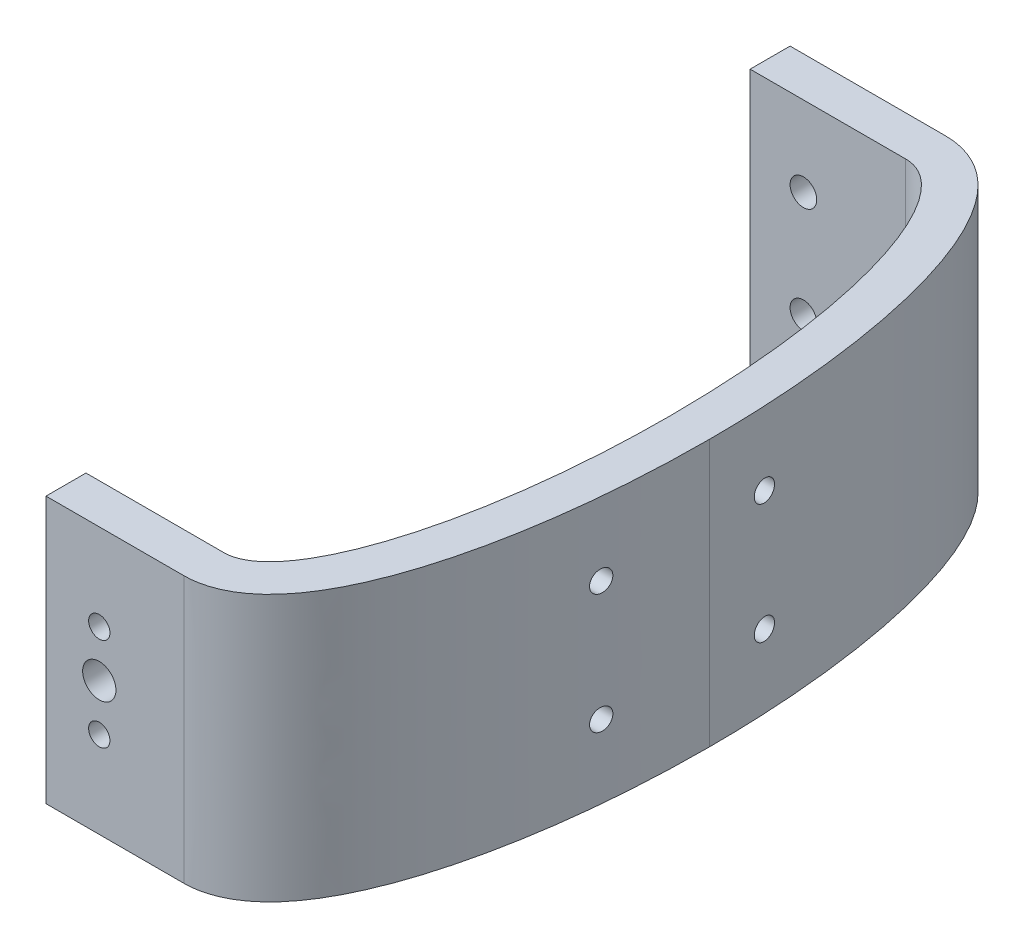
from build123d import *

# Parameters (mm, degrees)
EXTRUDE_1_DEPTH     = 40
SKETCH_2_W          = 20.699792116
SKETCH_2_H          = 40
EXTRUDE_2_DEPTH     = 6
SKETCH_3_W          = 23.355434
SKETCH_3_H          = 40
EXTRUDE_3_DEPTH     = 6
SKETCH_4_R          = 1.6
SKETCH_4_R_2        = 2.5
CUT_EXTRUDE_1_DEPTH = 6
SKETCH_5_R          = 2
CUT_EXTRUDE_2_DEPTH = 6
SKETCH_6_R          = 1.6
CUT_EXTRUDE_3_DEPTH = 50
SKETCH_7_R          = 3
CUT_EXTRUDE_4_DEPTH = 8.5


with BuildPart() as part:
    # 草图1 → 凸台-拉伸1 (new body)
    with BuildSketch(Plane(origin=(0, 20, 0), x_dir=(-1, 0, 0), z_dir=(0, -1, 0))):
        with BuildLine():
            Line((-222.278378746, 60.718506671), (-222.278378746, 54.718506671))
            add(Edge.make_bspline(
                [(-222.278378746, 54.718506671), (-230.961190407, 54.718506671), (-238, 31.801176865), (-238, 3.53121788)],
                knots=[0, 0, 0, 0, 1, 1, 1, 1], degree=3))
            add(Edge.make_bspline(
                [(-238, 3.53121788), (-238, -24.738741104), (-230.961190407, -47.656070911), (-222.278378746, -47.656070911)],
                knots=[0, 0, 0, 0, 1, 1, 1, 1], degree=3))
            Line((-222.278378746, -47.656070911), (-222.278378746, -53.656070911))
            add(Edge.make_bspline(
                [(-222.278378746, -53.656070911), (-223.180271244, -53.656070911), (-224.07933128, -53.571054967), (-224.960759777, -53.401588789), (-225.809203297, -53.154351153), (-226.615610963, -52.841063111), (-227.377447744, -52.473741453), (-228.814318367, -51.648078689), (-230.088209946, -50.667712485), (-230.687109525, -50.145609931), (-231.252366306, -49.596041043), (-231.788248358, -49.021505836), (-232.298365535, -48.423329927), (-233.760558431, -46.560400285), (-235.040687912, -44.496180714), (-235.833189955, -43.034044994), (-236.575699117, -41.484412798), (-237.274068793, -39.847154711), (-237.931584122, -38.12373571), (-239.787454092, -32.699420286), (-241.30112649, -26.534876341), (-242.165253789, -22.115163123), (-242.876330308, -17.414243288), (-243.426543113, -12.464468584), (-243.804818267, -7.299999889), (-244, -1.956138547), (-244, 3.53121788)],
                knots=[0, 0, 0, 0, 0, 0, 0, 0, 0, 0.125, 0.125, 0.125, 0.125, 0.125, 0.125, 0.25, 0.25, 0.25, 0.25, 0.25, 0.25, 0.5, 0.5, 0.5, 0.5, 0.5, 0.5, 1, 1, 1, 1, 1, 1, 1, 1, 1], degree=8))
            add(Edge.make_bspline(
                [(-244, 3.53121788), (-244, 9.018574307), (-243.804818267, 14.362435649), (-243.426543113, 19.526904345), (-242.876330308, 24.476679049), (-242.165253789, 29.177598883), (-241.30112649, 33.597312101), (-239.787454092, 39.761856046), (-237.931584122, 45.186171471), (-237.274068793, 46.909590472), (-236.575699117, 48.546848558), (-235.833189955, 50.096480754), (-235.040687912, 51.558616474), (-233.760558431, 53.622836045), (-232.298365535, 55.485765688), (-231.788248358, 56.083941596), (-231.252366306, 56.658476803), (-230.687109525, 57.208045691), (-230.088209946, 57.730148246), (-228.814318367, 58.710514449), (-227.377447744, 59.536177213), (-226.615610963, 59.903498872), (-225.809203297, 60.216786914), (-224.960759777, 60.464024549), (-224.07933128, 60.633490728), (-223.180271244, 60.718506671), (-222.278378746, 60.718506671)],
                knots=[0, 0, 0, 0, 0, 0, 0, 0, 0, 0.5, 0.5, 0.5, 0.5, 0.5, 0.5, 0.75, 0.75, 0.75, 0.75, 0.75, 0.75, 0.875, 0.875, 0.875, 0.875, 0.875, 0.875, 1, 1, 1, 1, 1, 1, 1, 1, 1], degree=8))
        make_face()
    extrude(amount=EXTRUDE_1_DEPTH)

    # 草图2 → 凸台-拉伸2 (add)
    with BuildSketch(Plane.XY.offset(47.656070911)):
        with Locations((211.928482688, 0)):
            Rectangle(SKETCH_2_W, SKETCH_2_H)
    extrude(amount=EXTRUDE_2_DEPTH)

    # 草图3 → 凸台-拉伸3 (add)
    with BuildSketch(Plane.XY.offset(-60.718506671)):
        with Locations((210.600661746, 0)):
            Rectangle(SKETCH_3_W, SKETCH_3_H)
    extrude(amount=EXTRUDE_3_DEPTH)

    # 草图4 → 切除-拉伸1 (cut)
    with BuildSketch(Plane.XY.offset(47.656070911)):
        with Locations((209.57858663, -7)):
            Circle(SKETCH_4_R)
        with Locations((209.57858663, 7)):
            Circle(SKETCH_4_R)
        with Locations((209.57858663, 0)):
            Circle(SKETCH_4_R_2)
    extrude(amount=CUT_EXTRUDE_1_DEPTH, mode=Mode.SUBTRACT)

    # 草图5 → 切除-拉伸2 (cut)
    with BuildSketch(Plane.XY.offset(-60.718506671)):
        with Locations((206.922944746, -8)):
            Circle(SKETCH_5_R)
        with Locations((206.922944746, 8)):
            Circle(SKETCH_5_R)
    extrude(amount=CUT_EXTRUDE_2_DEPTH, mode=Mode.SUBTRACT)

    # 草图6 → 切除-拉伸3 (cut)
    with BuildSketch(Plane(origin=(285, 0, 0), x_dir=(0, 0, -1), z_dir=(1, 0, 0))):
        with Locations((12, -9)):
            Circle(SKETCH_6_R)
        with Locations((-12, -9)):
            Circle(SKETCH_6_R)
        with Locations((12, 9)):
            Circle(SKETCH_6_R)
        with Locations((-12, 9)):
            Circle(SKETCH_6_R)
    extrude(amount=-CUT_EXTRUDE_3_DEPTH, mode=Mode.SUBTRACT)

    # 草图7 → 切除-拉伸4 (cut)
    with BuildSketch(Plane(origin=(230, 0, 0), x_dir=(0, 0, -1), z_dir=(1, 0, 0))):
        with Locations(Location((12, -9, 0), (0, 0, 180))):
            Circle(SKETCH_7_R)
        with Locations(Location((-12, -9, 0), (0, 0, 180))):
            Circle(SKETCH_7_R)
        with Locations(Location((12, 9, 0), (0, 0, 180))):
            Circle(SKETCH_7_R)
        with Locations(Location((-12, 9, 0), (0, 0, 180))):
            Circle(SKETCH_7_R)
    extrude(amount=CUT_EXTRUDE_4_DEPTH, mode=Mode.SUBTRACT)


solid = part.part
